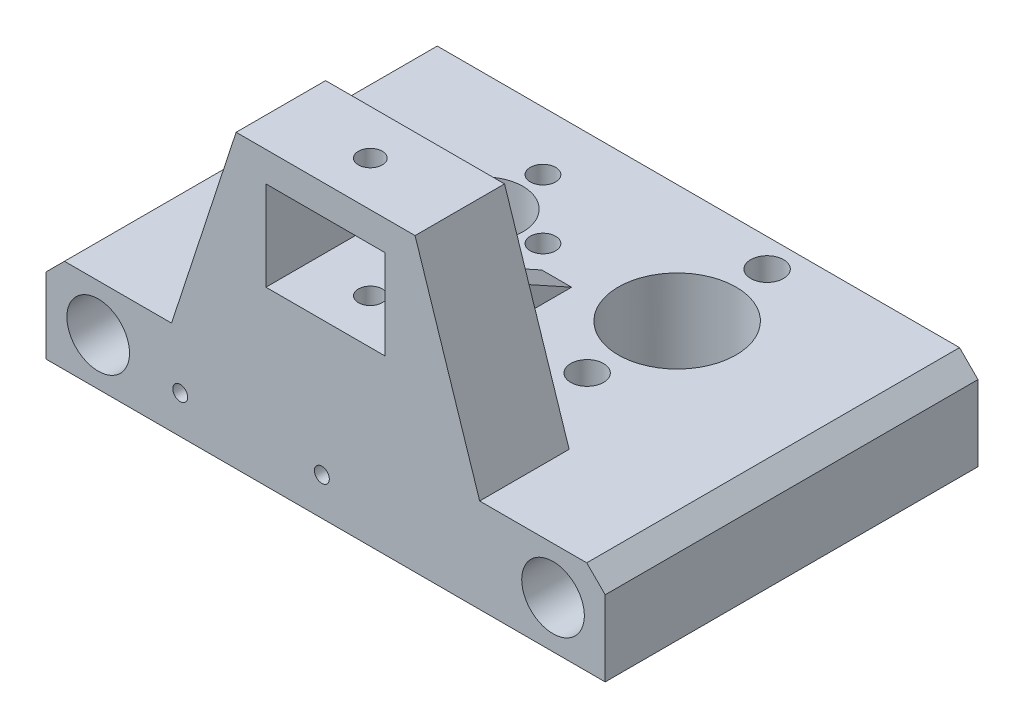
from build123d import *

# Parameters (mm, degrees)
SKETCH1_W           = 75
SKETCH1_H           = 50
SKETCH1_R           = 5.3
SKETCH1_R_2         = 7.9
BOSS_EXTRUDE1_DEPTH = 0.1
SKETCH2_W           = 12.5
SKETCH2_H           = 40
BOSS_EXTRUDE2_DEPTH = 12.5
SKETCH4_W           = 4
SKETCH4_H           = 12
BOSS_EXTRUDE3_DEPTH = 35
SKETCH5_W           = 24
SKETCH5_H           = 4
BOSS_EXTRUDE4_DEPTH = 12
SKETCH7_R           = 2.2
SKETCH7_R_2         = 1.7
CUT_EXTRUDE4_DEPTH  = 99.214051948
SKETCH8_W           = 16
SKETCH8_H           = 12
BOSS_EXTRUDE5_DEPTH = 23
BOSS_EXTRUDE6_DEPTH = 12
SKETCH6_R           = 1.6
CUT_EXTRUDE2_DEPTH  = 25
SKETCH10_W          = 4
SKETCH10_H          = 38
BOSS_EXTRUDE7_DEPTH = 2
BOSS_EXTRUDE8_DEPTH = 4
SKETCH12_W          = 5
SKETCH12_H          = 4.6
REVOLVE1_ANGLE      = 90
BOSS_EXTRUDE9_START = 12.5
SKETCH14_R          = 2.2
SKETCH14_R_2        = 7.9
SKETCH14_R_3        = 1.7
SKETCH14_R_4        = 5.3
BOSS_EXTRUDE9_DEPTH = 12.5
SKETCH3_R           = 4.2
CUT_EXTRUDE1_DEPTH  = 99.253803998
SKETCH15_R          = 1
CUT_EXTRUDE5_DEPTH  = 8


with BuildPart() as part:
    # Sketch1 → Boss-Extrude1 (new body)
    with BuildSketch(Plane(origin=(0, 0, 0), x_dir=(1, 0, 0), z_dir=(0, 1, 0))):
        with Locations((37.5, 25)):
            Rectangle(SKETCH1_W, SKETCH1_H)
        with Locations(Location((24.5, 34.15, 0), (0, 0, 270))):
            Circle(SKETCH1_R, mode=Mode.SUBTRACT)
        with Locations(Location((50.5, 34.15, 0), (0, 0, 270))):
            Circle(SKETCH1_R_2, mode=Mode.SUBTRACT)
    extrude(amount=BOSS_EXTRUDE1_DEPTH)

    # Sketch2 → Boss-Extrude2 (add)
    with BuildSketch(Plane(origin=(0, 0.1, 0), x_dir=(1, 0, 0), z_dir=(0, 1, 0))):
        with Locations((6.25, 30)):
            Rectangle(SKETCH2_W, SKETCH2_H)
        with Locations((68.75, 30)):
            Rectangle(SKETCH2_W, SKETCH2_H)
    extrude(amount=BOSS_EXTRUDE2_DEPTH)

    # Sketch4 → Boss-Extrude3 (add)
    with BuildSketch(Plane(origin=(0, 0.1, 0), x_dir=(1, 0, 0), z_dir=(0, 1, 0))):
        with Locations((47.5, 6)):
            Rectangle(SKETCH4_W, SKETCH4_H)
        with Locations((27.5, 6)):
            Rectangle(SKETCH4_W, SKETCH4_H)
    extrude(amount=BOSS_EXTRUDE3_DEPTH)

    # Sketch5 → Boss-Extrude4 (add)
    with BuildSketch(Plane(origin=(0, 0, -12), x_dir=(-1, 0, 0), z_dir=(0, 0, -1))):
        with Locations((-37.5, 37.1)):
            Rectangle(SKETCH5_W, SKETCH5_H)
    extrude(amount=-BOSS_EXTRUDE4_DEPTH)

    # Sketch7 → Cut-Extrude4 (cut, through all)
    with BuildSketch(Plane(origin=(0, 0.1, 0), x_dir=(1, 0, 0), z_dir=(0, 1, 0))):
        with Locations(Location((50.5, 22.08, 0), (0, 0, 270))):
            Circle(SKETCH7_R)
        with Locations(Location((50.5, 46.215, 0), (0, 0, 270))):
            Circle(SKETCH7_R)
        with Locations(Location((24.5, 42.15, 0), (0, 0, 270))):
            Circle(SKETCH7_R_2)
        with Locations(Location((16.5, 34.15, 0), (0, 0, 270))):
            Circle(SKETCH7_R_2)
        with Locations(Location((32.5, 34.15, 0), (0, 0, 90))):
            Circle(SKETCH7_R_2)
        with Locations(Location((24.5, 26.15, 0), (0, 0, 90))):
            Circle(SKETCH7_R_2)
    extrude(amount=-CUT_EXTRUDE4_DEPTH, mode=Mode.SUBTRACT)

    # Sketch8 → Boss-Extrude5 (add)
    with BuildSketch(Plane(origin=(0, 0.1, 0), x_dir=(1, 0, 0), z_dir=(0, 1, 0))):
        with Locations((37.5, 6)):
            Rectangle(SKETCH8_W, SKETCH8_H)
    extrude(amount=BOSS_EXTRUDE5_DEPTH)

    # Sketch9 → Boss-Extrude6 (add)
    with BuildSketch(Plane.XY):
        Polygon((49.5, 39.1), (62.25, 0.1), (49.5, 0.1), align=None)
        Polygon((12.75, 0.1), (25.5, 0.1), (25.5, 39.1), align=None)
    extrude(amount=-BOSS_EXTRUDE6_DEPTH)

    # Sketch6 → Cut-Extrude2 (cut)
    with BuildSketch(Plane(origin=(0, 39.1, 0), x_dir=(1, 0, 0), z_dir=(0, 1, 0))):
        with Locations(Location((37.5, 6, 0), (0, 0, 270))):
            Circle(SKETCH6_R)
    extrude(amount=-CUT_EXTRUDE2_DEPTH, mode=Mode.SUBTRACT)

    # Sketch10 → Boss-Extrude7 (add)
    with BuildSketch(Plane(origin=(0, 0.1, 0), x_dir=(1, 0, 0), z_dir=(0, 1, 0))):
        with Locations((37.5, 31)):
            Rectangle(SKETCH10_W, SKETCH10_H)
    extrude(amount=BOSS_EXTRUDE7_DEPTH)

    # Sketch11 → Boss-Extrude8 (add)
    with BuildSketch(Plane(origin=(39.5, 0, 0), x_dir=(0, 0, -1), z_dir=(1, 0, 0))):
        Polygon((50, 2.1), (12, 2.1), (12, 23.1), align=None)
    extrude(amount=-BOSS_EXTRUDE8_DEPTH)

    # Sketch12 → Revolve1 (revolve)
    with BuildSketch(Plane(origin=(0, 0.1, 0), x_dir=(1, 0, 0), z_dir=(0, 1, 0))):
        with Locations((42, 14.3)):
            Rectangle(SKETCH12_W, SKETCH12_H)
        with Locations((33, 14.3)):
            Rectangle(SKETCH12_W, SKETCH12_H)
    revolve(axis=Axis((39.5, 0.1, -12), (1, 0, 0)), revolution_arc=REVOLVE1_ANGLE)

    # Sketch14 → Boss-Extrude9 (add)
    # profile 1 of 4: a face of its own
    with BuildSketch(Plane(origin=(0, 0.1, 0), x_dir=(1, 0, 0), z_dir=(0, 1, 0)).offset(BOSS_EXTRUDE9_START)):
        Polygon((62.25, 12), (62.25, 10), (62.5, 10), (62.5, 50), (39.5, 50), (39.5, 16.6), (44.5, 16.6), (44.5, 12), align=None)
        with Locations(Location((50.5, 22.08, 0), (0, 0, 270))):
            Circle(SKETCH14_R, mode=Mode.SUBTRACT)
        with Locations(Location((50.5, 34.15, 0), (0, 0, 90))):
            Circle(SKETCH14_R_2, mode=Mode.SUBTRACT)
        with Locations(Location((50.5, 46.215, 0), (0, 0, 270))):
            Circle(SKETCH14_R, mode=Mode.SUBTRACT)
    # profile 2 of 4: a face of its own
    with BuildSketch(Plane(origin=(0, 0.1, 0), x_dir=(1, 0, 0), z_dir=(0, 1, 0)).offset(BOSS_EXTRUDE9_START)):
        Polygon((62.25, 0), (75, 0), (75, 10), (62.5, 10), (62.25, 10), align=None)
    # profile 3 of 4: a face of its own
    with BuildSketch(Plane(origin=(0, 0.1, 0), x_dir=(1, 0, 0), z_dir=(0, 1, 0)).offset(BOSS_EXTRUDE9_START)):
        Polygon((12.5, 10), (62.25, 10), (62.25, 12), (44.5, 12), (44.5, 16.6), (39.5, 16.6), (39.5, 50), (12.5, 50), align=None)
        with Locations(Location((16.5, 34.15, 0), (0, 0, 270))):
            Circle(SKETCH14_R_3, mode=Mode.SUBTRACT)
        with Locations(Location((24.5, 26.15, 0), (0, 0, 90))):
            Circle(SKETCH14_R_3, mode=Mode.SUBTRACT)
        with Locations(Location((24.5, 34.15, 0), (0, 0, 90))):
            Circle(SKETCH14_R_4, mode=Mode.SUBTRACT)
        with Locations(Location((32.5, 34.15, 0), (0, 0, 90))):
            Circle(SKETCH14_R_3, mode=Mode.SUBTRACT)
        with Locations(Location((24.5, 42.15, 0), (0, 0, 270))):
            Circle(SKETCH14_R_3, mode=Mode.SUBTRACT)
    # profile 4 of 4: a face of its own
    with BuildSketch(Plane(origin=(0, 0.1, 0), x_dir=(1, 0, 0), z_dir=(0, 1, 0)).offset(BOSS_EXTRUDE9_START)):
        Polygon((0, 0), (62.25, 0), (62.25, 10), (12.5, 10), (0, 10), align=None)
    extrude(amount=-BOSS_EXTRUDE9_DEPTH)

    # Sketch3 → Cut-Extrude1 (cut, through all)
    with BuildSketch(Plane(origin=(0, 0, -50), x_dir=(-1, 0, 0), z_dir=(0, 0, -1))):
        with Locations((-68, 6.3)):
            Circle(SKETCH3_R)
        with Locations(Location((-7, 6.3, 0), (0, 0, 180))):
            Circle(SKETCH3_R)
        Polygon((-72.525126266, 12.6), (-75, 12.6), (-75, 10.125126266), align=None)
        Polygon((0, 10.125126266), (-2.474873734, 12.6), (0, 12.6), align=None)
    extrude(amount=-CUT_EXTRUDE1_DEPTH, mode=Mode.SUBTRACT)

    # Sketch15 → Cut-Extrude5 (cut)
    with BuildSketch(Plane.XY):
        with Locations((18, 5.062563133)):
            Circle(SKETCH15_R)
        with Locations((37, 5.062563133)):
            Circle(SKETCH15_R)
    extrude(amount=-CUT_EXTRUDE5_DEPTH, mode=Mode.SUBTRACT)


solid = part.part
